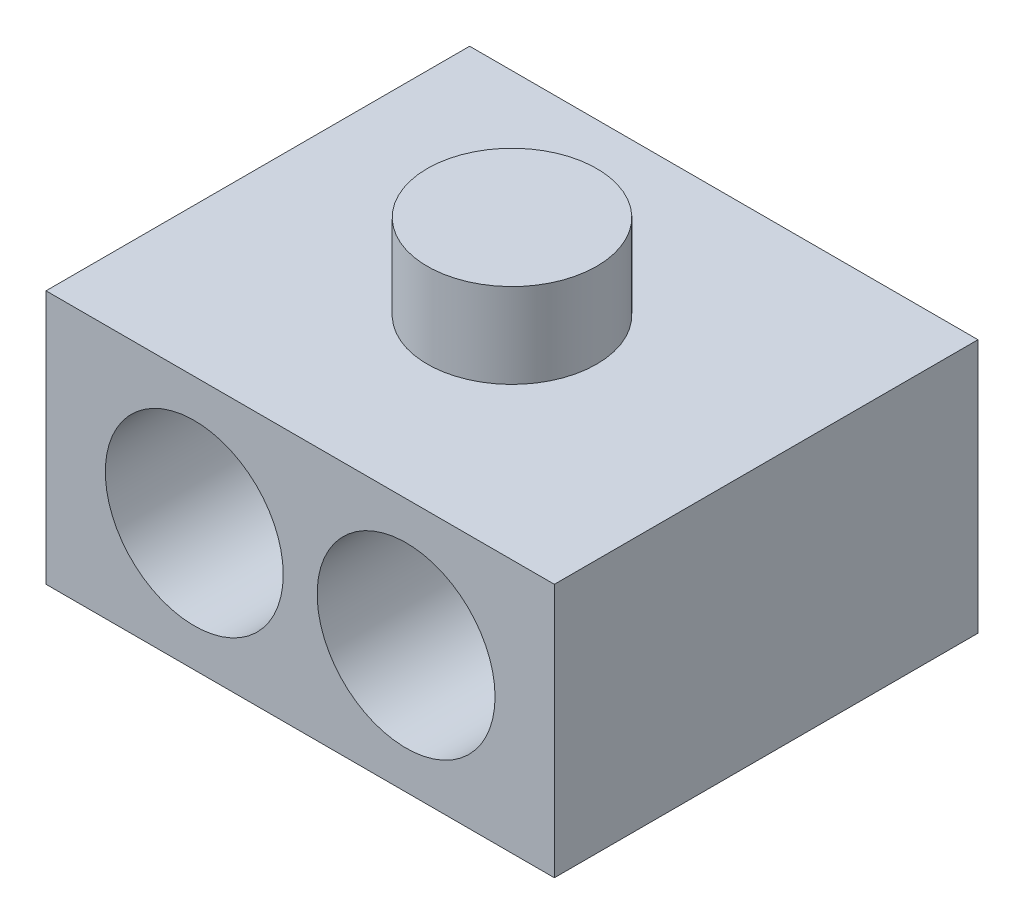
from build123d import *

# Parameters (mm, degrees)
SKETCH1_W           = 50
SKETCH1_H           = 30
BOSS_EXTRUDE1_DEPTH = 10
SKETCH2_R           = 7.5
CUT_EXTRUDE1_DEPTH  = 10
SKETCH3_W           = 50
SKETCH3_H           = 30
BOSS_EXTRUDE2_DEPTH = 40
SKETCH4_R           = 10.5
CUT_EXTRUDE2_DEPTH  = 40
SKETCH5_W           = 50
SKETCH5_H           = 30
BOSS_EXTRUDE3_DEPTH = 5
SKETCH6_W           = 50
SKETCH6_H           = 30
BOSS_EXTRUDE4_DEPTH = 5
SKETCH7_R           = 10
BOSS_EXTRUDE5_DEPTH = 10


with BuildPart() as part:
    # Sketch1 → Boss-Extrude1 (new body)
    with BuildSketch(Plane.XY):
        with Locations((-25, 15)):
            Rectangle(SKETCH1_W, SKETCH1_H)
    extrude(amount=BOSS_EXTRUDE1_DEPTH)

    # Sketch2 → Cut-Extrude1 (cut)
    with BuildSketch(Plane.XY.offset(10)):
        with Locations((-37.5, 15)):
            Circle(SKETCH2_R)
        with Locations((-12.5, 15)):
            Circle(SKETCH2_R)
    extrude(amount=-CUT_EXTRUDE1_DEPTH, mode=Mode.SUBTRACT)

    # Sketch3 → Boss-Extrude2 (add)
    with BuildSketch(Plane.XY.offset(10)):
        with Locations((-25, 15)):
            Rectangle(SKETCH3_W, SKETCH3_H)
    extrude(amount=BOSS_EXTRUDE2_DEPTH)

    # Sketch4 → Cut-Extrude2 (cut)
    with BuildSketch(Plane.XY.offset(50)):
        with Locations((-37.5, 15)):
            Circle(SKETCH4_R)
        with Locations((-12.5, 15)):
            Circle(SKETCH4_R)
    extrude(amount=-CUT_EXTRUDE2_DEPTH, mode=Mode.SUBTRACT)

    # Sketch5 → Boss-Extrude3 (add)
    with BuildSketch(Plane(origin=(0, 0, 0), x_dir=(0, 0, -1), z_dir=(1, 0, 0))):
        with Locations((-25, 15)):
            Rectangle(SKETCH5_W, SKETCH5_H)
    extrude(amount=BOSS_EXTRUDE3_DEPTH)

    # Sketch6 → Boss-Extrude4 (add)
    with BuildSketch(Plane.ZY.offset(50)):
        with Locations((25, 15)):
            Rectangle(SKETCH6_W, SKETCH6_H)
    extrude(amount=BOSS_EXTRUDE4_DEPTH)

    # Sketch7 → Boss-Extrude5 (add)
    with BuildSketch(Plane(origin=(0, 30, 0), x_dir=(1, 0, 0), z_dir=(0, 1, 0))):
        with Locations(Location((-25, -25, 0), (0, 0, 180))):
            Circle(SKETCH7_R)
    extrude(amount=BOSS_EXTRUDE5_DEPTH)


solid = part.part
